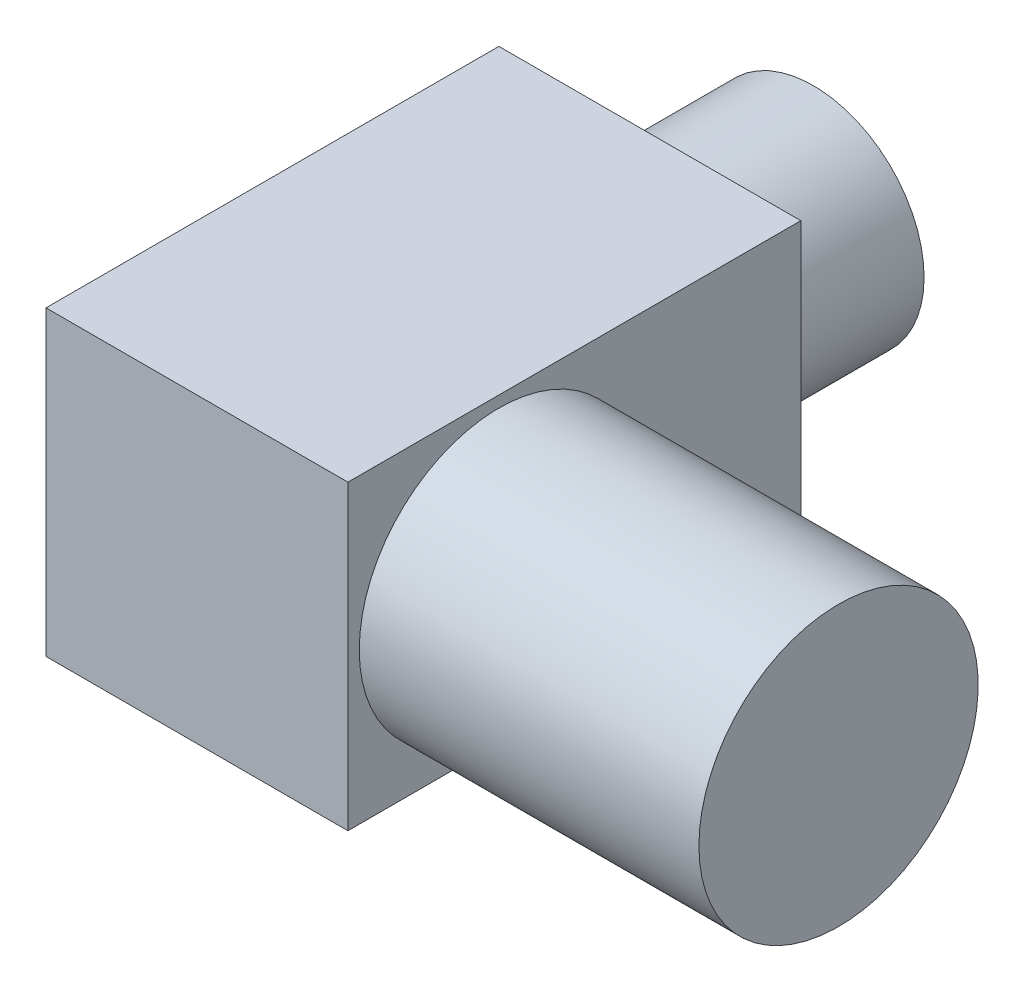
from build123d import *

# Parameters (mm, degrees)
RC_START                                     = -6.5
SKETCH1_R                                    = 4.4
RC_1_8_CONNECTION_THREAD_CORE_ENVELOPE_DEPTH = 6.5
SKETCH2_W                                    = 12
SKETCH2_H                                    = 12
ELBOW_BODY_AND_12_MM_WRENCH_FLATS_DEPTH      = 18
MALE_START                                   = 5.8
SKETCH3_R                                    = 5.55
MALE_4_JIC_OUTLET_ENVELOPE_DEPTH             = 13.7


with BuildPart() as part:
    # Sketch1 → Rc 1/8 connection, thread core envelope (new body)
    with BuildSketch(Plane.XY.offset(RC_START)):
        with Locations(Location((0, 0, 0), (0, 0, 180))):
            Circle(SKETCH1_R)
    extrude(amount=RC_1_8_CONNECTION_THREAD_CORE_ENVELOPE_DEPTH)

    # Sketch2 → Elbow body and 12 mm wrench flats (add)
    with BuildSketch(Plane.XY):
        Rectangle(SKETCH2_W, SKETCH2_H)
    extrude(amount=ELBOW_BODY_AND_12_MM_WRENCH_FLATS_DEPTH)

    # Sketch3 → Male -4 JIC outlet envelope (add)
    with BuildSketch(Plane(origin=(0, 0, 0), x_dir=(0, 0, -1), z_dir=(1, 0, 0)).offset(MALE_START)):
        with Locations(Location((-12, 0, 0), (0, 0, 180))):
            Circle(SKETCH3_R)
    extrude(amount=MALE_4_JIC_OUTLET_ENVELOPE_DEPTH)


solid = part.part
